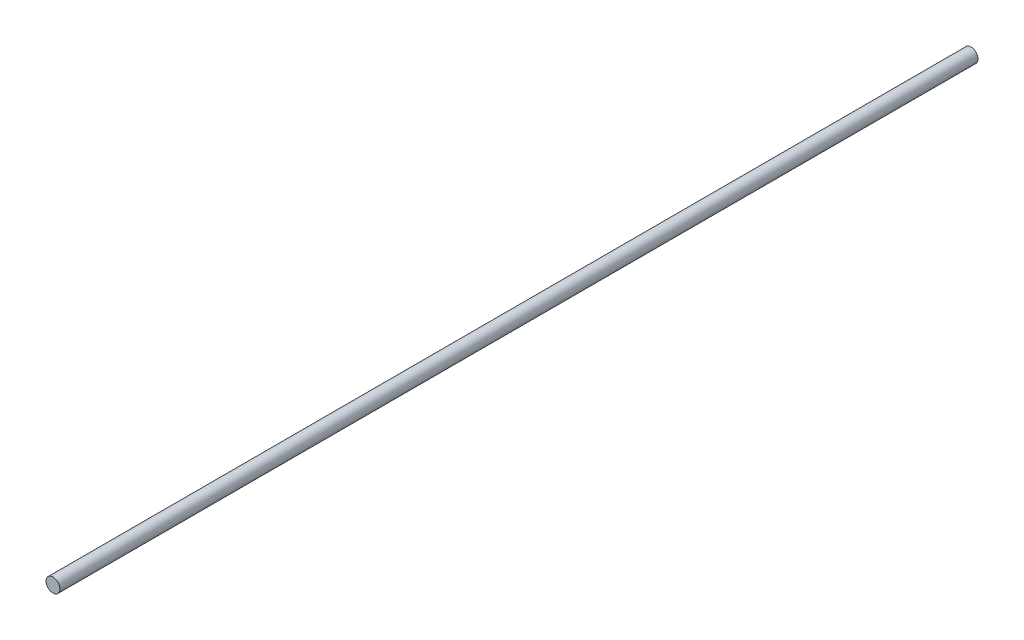
from build123d import *

# Parameters (mm, degrees)
SKETCH1_R           = 1.7
BOSS_EXTRUDE1_DEPTH = 210
BOSS_EXTRUDE2_START = 15
SKETCH2_R           = 1.7
BOSS_EXTRUDE2_DEPTH = 15


with BuildPart() as part:
    # Sketch1 → Boss-Extrude1 (new body)
    with BuildSketch(Plane.XY):
        Circle(SKETCH1_R)
    extrude(amount=BOSS_EXTRUDE1_DEPTH)

    # Sketch2 → Boss-Extrude2 (add)
    with BuildSketch(Plane(origin=(0, 0, 0), x_dir=(-1, 0, 0), z_dir=(0, 0, -1)).offset(BOSS_EXTRUDE2_START)):
        Circle(SKETCH2_R)
    extrude(amount=-BOSS_EXTRUDE2_DEPTH)


solid = part.part
